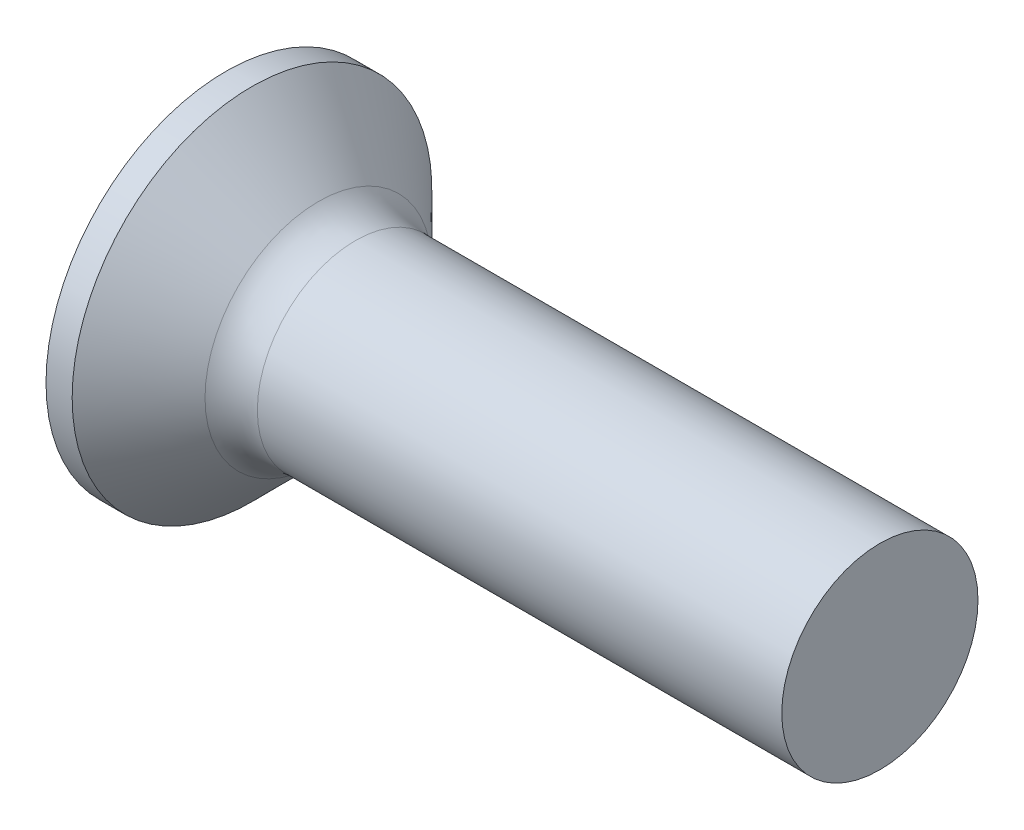
from build123d import *

# Parameters (mm, degrees)
FILLET1_R    = 0.8
RECPAT_COUNT = 2
RECPAT_ANGLE = 90


with BuildPart() as part:
    # BodySke → Base-Revolve (revolve)
    with BuildSketch(Plane.XY, mode=Mode.PRIVATE) as base_revolve_sk:
        Polygon((0, 0), (0, 2.75), (0.4, 2.75), (1.65, 1.5), (10, 1.5), (10, 0), align=None)
    revolve(base_revolve_sk.sketch.rotate(Axis((-6.35, 0, 0), (1, 0, 0)), 90), axis=Axis((-6.35, 0, 0), (1, 0, 0)))

    # Fillet1
    fillet1_edges = [part.edges().sort_by_distance(p)[0] for p in [
        (1.65, 0, -1.5),
    ]]
    fillet(fillet1_edges, radius=FILLET1_R)

    # Sketch3 → Recess section 0
    with BuildSketch(Plane.ZY):
        with BuildLine():
            Line((-0.37, 1.5), (0.37, 1.5))
            Line((0.37, 1.5), (0.37, -1.5))
            Line((0.37, -1.5), (-0.37, -1.5))
            Line((-0.37, -1.5), (-0.37, 1.5))
        make_face()
    # Sketch4 → Recess section 1
    with BuildSketch(Plane.ZY.offset(-2.01)):
        with BuildLine():
            Line((-0.37, 0.497851135), (0.37, 0.497851135))
            Line((0.37, 0.497851135), (0.37, -0.497851135))
            Line((0.37, -0.497851135), (-0.37, -0.497851135))
            Line((-0.37, -0.497851135), (-0.37, 0.497851135))
        make_face()
    recess = loft(mode=Mode.SUBTRACT)

    # RecPat: Recess ×2 about axis
    recpat_axis = Axis((0, 0, 0), (1, 0, 0))
    for i in range(1, RECPAT_COUNT):
        add(recess.rotate(recpat_axis, i * RECPAT_ANGLE / (RECPAT_COUNT - 1)), mode=Mode.SUBTRACT)

    # RecCorSke → RecessCore (revolve, cut)
    with BuildSketch(Plane.XY, mode=Mode.PRIVATE) as recesscore_sk:
        Polygon((0, 0), (0, 0.696552892), (2.01, 0.556), (2.190655351, 0), align=None)
    revolve(recesscore_sk.sketch.rotate(Axis((-3.175, 0, 0), (1, 0, 0)), 90), axis=Axis((-3.175, 0, 0), (1, 0, 0)), mode=Mode.SUBTRACT)


solid = part.part
